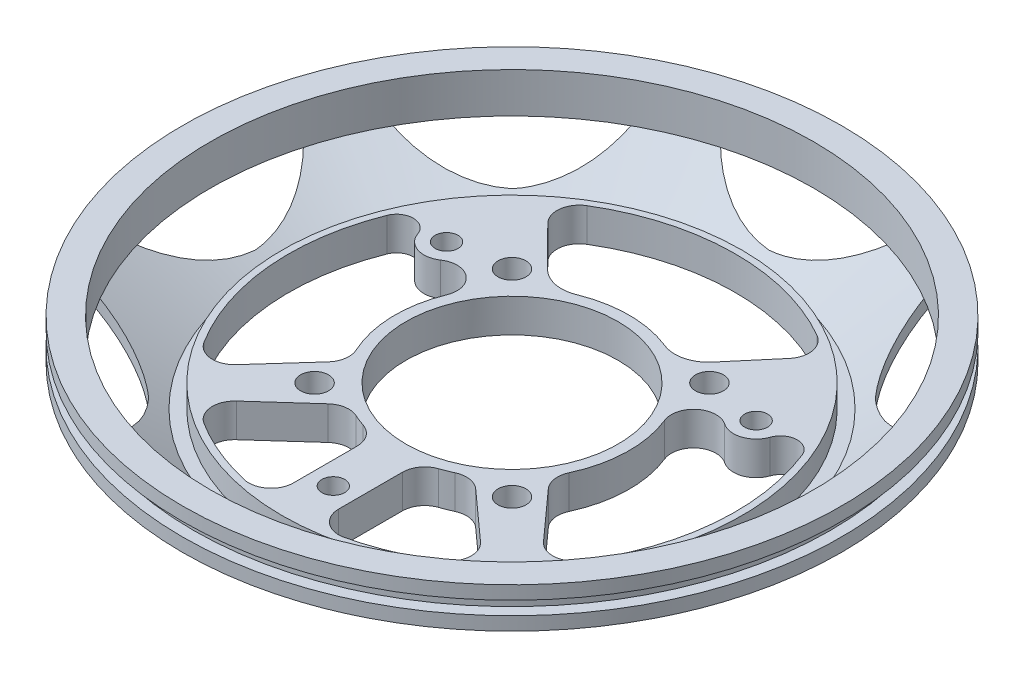
from build123d import *

# Parameters (mm, degrees)
SKETCH5_R                = 9.5
CUT_EXTRUDE1_DEPTH       = 4.6
M3X0_5_TAPPED_HOLE1_D    = 2.5
M2_5X0_45_TAPPED_HOLE1_D = 2.05
CUT_EXTRUDE2_DEPTH       = 4.6


with BuildPart() as part:
    # Sketch2 → Revolve1 (revolve)
    with BuildSketch(Plane(origin=(0, 0, 0), x_dir=(0, 0, -1), z_dir=(1, 0, 0)), mode=Mode.PRIVATE) as revolve1_sk:
        Polygon((-29.5, 0), (-29.5, -1.2), (-28.5, -1.2), (-28.5, -2.4), (-29.5, -2.4), (-29.5, -3.6), (-27, -3.6), (-27, 0), align=None)
    revolve(revolve1_sk.sketch.rotate(Axis((0, 0, 0), (0, 1, 0)), 180), axis=Axis((0, 0, 0), (0, 1, 0)))

    # Sketch4 → Revolve2 (revolve)
    with BuildSketch(Plane(origin=(0, 0, 0), x_dir=(0, 0, -1), z_dir=(1, 0, 0))):
        Polygon((-29.5, -3.6), (-22, -8.2), (0, -8.2), (0, -5.2), (-21.153285681, -5.2), (-23.761981333, -3.6), align=None)
    revolve(axis=Axis((0, 0, 0), (0, -1, 0)))

    # Sketch10 → Cut-Revolve1 (revolve, cut)
    with BuildSketch(Plane(origin=(0, 0, 0), x_dir=(0, 0, -1), z_dir=(1, 0, 0))):
        Polygon((-27.587779714, -3.6), (-21.717779714, -7.2), (-20.587779714, -7.2), (-20.587779714, -3.6), align=None)
    revolve(axis=Axis((0, 0, 0), (0, -1, 0)), mode=Mode.SUBTRACT)

    # Sketch5 → Cut-Extrude1 (cut)
    with BuildSketch(Plane.XZ.offset(8.2)):
        with Locations(Location((0, 0, 0), (0, 0, 270))):
            Circle(SKETCH5_R)
        with BuildLine():
            Line((-9.15, -28.045097611), (-9.15, -31.045097611))
            Line((-9.15, -31.045097611), (9.15, -31.045097611))
            Line((9.15, -31.045097611), (9.15, -28.045097611))
            ThreePointArc((9.15, -28.045097611), (5.152935073, -24.474381589), (0, -23))
            ThreePointArc((0, -23), (-5.152935073, -24.474381589), (-9.15, -28.045097611))
        make_face()
        with BuildLine():
            Line((-15.482171995, -28.422226091), (-28.422226091, -15.482171995))
            Line((-28.422226091, -15.482171995), (-26.300905748, -13.360851652))
            ThreePointArc((-26.300905748, -13.360851652), (-20.94967652, -13.662325854), (-16.263455967, -16.263455967))
            ThreePointArc((-16.263455967, -16.263455967), (-13.662325854, -20.94967652), (-13.360851652, -26.300905748))
            Line((-13.360851652, -26.300905748), (-15.482171995, -28.422226091))
        make_face()
        with BuildLine():
            Line((-31.045097611, -9.15), (-31.045097611, 9.15))
            Line((-31.045097611, 9.15), (-28.045097611, 9.15))
            ThreePointArc((-28.045097611, 9.15), (-24.474381589, 5.152935073), (-23, 0))
            ThreePointArc((-23, 0), (-24.474381589, -5.152935073), (-28.045097611, -9.15))
            Line((-28.045097611, -9.15), (-31.045097611, -9.15))
        make_face()
        with BuildLine():
            Line((-28.422226091, 15.482171995), (-15.482171995, 28.422226091))
            Line((-15.482171995, 28.422226091), (-13.360851652, 26.300905748))
            ThreePointArc((-13.360851652, 26.300905748), (-13.662325854, 20.94967652), (-16.263455967, 16.263455967))
            ThreePointArc((-16.263455967, 16.263455967), (-20.94967652, 13.662325854), (-26.300905748, 13.360851652))
            Line((-26.300905748, 13.360851652), (-28.422226091, 15.482171995))
        make_face()
        with BuildLine():
            Line((-9.15, 31.045097611), (9.15, 31.045097611))
            Line((9.15, 31.045097611), (9.15, 28.045097611))
            ThreePointArc((9.15, 28.045097611), (5.152935073, 24.474381589), (0, 23))
            ThreePointArc((0, 23), (-5.152935073, 24.474381589), (-9.15, 28.045097611))
            Line((-9.15, 28.045097611), (-9.15, 31.045097611))
        make_face()
        with BuildLine():
            Line((15.482171995, 28.422226091), (28.422226091, 15.482171995))
            Line((28.422226091, 15.482171995), (26.300905748, 13.360851652))
            ThreePointArc((26.300905748, 13.360851652), (20.94967652, 13.662325854), (16.263455967, 16.263455967))
            ThreePointArc((16.263455967, 16.263455967), (13.662325854, 20.94967652), (13.360851652, 26.300905748))
            Line((13.360851652, 26.300905748), (15.482171995, 28.422226091))
        make_face()
        with BuildLine():
            Line((31.045097611, 9.15), (31.045097611, -9.15))
            Line((31.045097611, -9.15), (28.045097611, -9.15))
            ThreePointArc((28.045097611, -9.15), (24.474381589, -5.152935073), (23, 0))
            ThreePointArc((23, 0), (24.474381589, 5.152935073), (28.045097611, 9.15))
            Line((28.045097611, 9.15), (31.045097611, 9.15))
        make_face()
        with BuildLine():
            Line((28.422226091, -15.482171995), (15.482171995, -28.422226091))
            Line((15.482171995, -28.422226091), (13.360851652, -26.300905748))
            ThreePointArc((13.360851652, -26.300905748), (13.662325854, -20.94967652), (16.263455967, -16.263455967))
            ThreePointArc((16.263455967, -16.263455967), (20.94967652, -13.662325854), (26.300905748, -13.360851652))
            Line((26.300905748, -13.360851652), (28.422226091, -15.482171995))
        make_face()
    extrude(amount=-CUT_EXTRUDE1_DEPTH, mode=Mode.SUBTRACT)

    # M3x0.5 Tapped Hole1 (through all)
    with Locations(Plane(origin=(8.838834765, -8.2, 8.838834765), x_dir=(0, 0, -1), z_dir=(0, -1, 0))):
        with Locations((0, 0), (0, -17.67766953), (17.67766953, -17.67766953), (17.67766953, 0)):
            Hole(M3X0_5_TAPPED_HOLE1_D / 2)

    # M2.5x0.45 Tapped Hole1 (through all)
    with Locations(Plane(origin=(0, -8.2, 16), x_dir=(0, 0, -1), z_dir=(0, -1, 0))):
        with Locations((0, 0), (24, -13.856406461), (24, 13.856406461)):
            Hole(M2_5X0_45_TAPPED_HOLE1_D / 2)

    # Sketch11 → Cut-Extrude2 (cut)
    with BuildSketch(Plane.XZ.offset(8.2)):
        with BuildLine():
            Line((-7.209952282, -10.391722407), (-10.768274297, -13.971106124))
            ThreePointArc((-10.768274297, -13.971106124), (-11.335252018, -15.622704458), (-10.388770996, -17.090156149))
            ThreePointArc((-10.388770996, -17.090156149), (-0.231781492, -19.998656888), (9.989888846, -17.326341819))
            ThreePointArc((9.989888846, -17.326341819), (10.961219788, -15.936985635), (10.516977206, -14.301001853))
            Line((10.516977206, -14.301001853), (7.358917977, -10.572819941))
            ThreePointArc((7.358917977, -10.572819941), (5.787310822, -9.598945174), (3.94317942, -9.731461147))
            ThreePointArc((3.94317942, -9.731461147), (-0.005279479, -10.499998673), (-3.952963529, -9.727490906))
            ThreePointArc((-3.952963529, -9.727490906), (-5.681863082, -9.56728052), (-7.209952282, -10.391722407))
        make_face()
        with BuildLine():
            Line((-9.851753888, 6.601223183), (-13.746934374, 10.927259378))
            ThreePointArc((-13.746934374, 10.927259378), (-15.40423937, 11.581673189), (-16.925804472, 10.654442405))
            ThreePointArc((-16.925804472, 10.654442405), (-19.916533775, 1.825289678), (-18.580475798, -7.400399929))
            ThreePointArc((-18.580475798, -7.400399929), (-17.152955805, -8.344984907), (-15.76969175, -7.336701877))
            ThreePointArc((-15.76969175, -7.336701877), (-14.493755054, -6.077914734), (-12.71849928, -6.324950076))
            ThreePointArc((-12.71849928, -6.324950076), (-10.339375321, -6.227599287), (-9.739497882, -3.923287016))
            ThreePointArc((-9.739497882, -3.923287016), (-10.496498644, 0.271138733), (-9.523956573, 4.420888055))
            ThreePointArc((-9.523956573, 4.420888055), (-9.360270354, 5.56030559), (-9.851753888, 6.601223183))
        make_face()
        with BuildLine():
            Line((-6.601223183, 9.851753888), (-10.927259378, 13.746934374))
            ThreePointArc((-10.927259378, 13.746934374), (-11.581673189, 15.40423937), (-10.654442405, 16.925804472))
            ThreePointArc((-10.654442405, 16.925804472), (-7.67152848, 18.470182749), (-4.472222222, 19.493568898))
            ThreePointArc((-4.472222222, 19.493568898), (-2.778894957, 19.108572013), (-2.025, 17.544212009))
            Line((-2.025, 17.544212009), (-2.025, 11.834245857))
            ThreePointArc((-2.025, 11.834245857), (-2.39896187, 10.669771727), (-3.381, 9.94076652))
            ThreePointArc((-3.381, 9.94076652), (-3.906507, 9.746240458), (-4.420888055, 9.523956573))
            ThreePointArc((-4.420888055, 9.523956573), (-5.56030559, 9.360270354), (-6.601223183, 9.851753888))
        make_face()
        with BuildLine():
            Line((6.601223183, 9.851753888), (10.927259378, 13.746934374))
            ThreePointArc((10.927259378, 13.746934374), (11.581673189, 15.40423937), (10.654442405, 16.925804472))
            ThreePointArc((10.654442405, 16.925804472), (7.67152848, 18.470182749), (4.472222222, 19.493568898))
            ThreePointArc((4.472222222, 19.493568898), (2.778894957, 19.108572013), (2.025, 17.544212009))
            Line((2.025, 17.544212009), (2.025, 11.834245857))
            ThreePointArc((2.025, 11.834245857), (2.39896187, 10.669771727), (3.381, 9.94076652))
            ThreePointArc((3.381, 9.94076652), (3.906507, 9.746240458), (4.420888055, 9.523956573))
            ThreePointArc((4.420888055, 9.523956573), (5.56030559, 9.360270354), (6.601223183, 9.851753888))
        make_face()
        with BuildLine():
            Line((9.851753888, 6.601223183), (13.746934374, 10.927259378))
            ThreePointArc((13.746934374, 10.927259378), (15.40423937, 11.581673189), (16.925804472, 10.654442405))
            ThreePointArc((16.925804472, 10.654442405), (19.916533775, 1.825289678), (18.580475798, -7.400399929))
            ThreePointArc((18.580475798, -7.400399929), (17.152955805, -8.344984907), (15.76969175, -7.336701877))
            ThreePointArc((15.76969175, -7.336701877), (14.493755054, -6.077914734), (12.71849928, -6.324950076))
            ThreePointArc((12.71849928, -6.324950076), (10.339375321, -6.227599287), (9.739497882, -3.923287016))
            ThreePointArc((9.739497882, -3.923287016), (10.496498644, 0.271138733), (9.523956573, 4.420888055))
            ThreePointArc((9.523956573, 4.420888055), (9.360270354, 5.56030559), (9.851753888, 6.601223183))
        make_face()
    extrude(amount=-CUT_EXTRUDE2_DEPTH, mode=Mode.SUBTRACT)


solid = part.part
